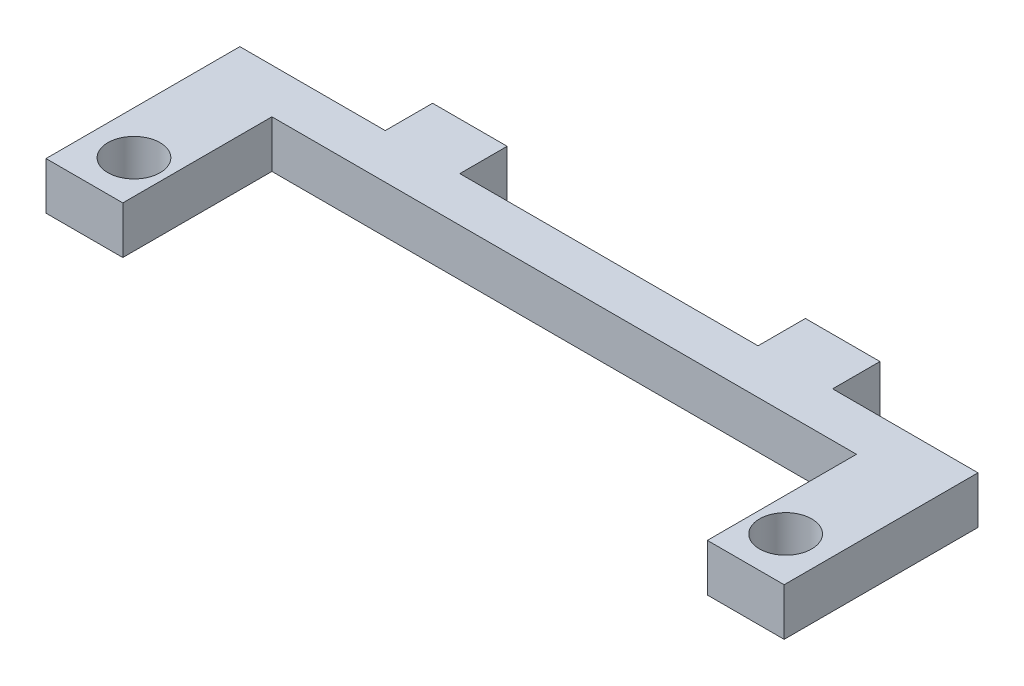
from build123d import *

# Parameters (mm, degrees)
SKETCH1_R           = 1.75
BOSS_EXTRUDE1_DEPTH = 3.175


with BuildPart() as part:
    # Sketch1 → Boss-Extrude1 (new body)
    with BuildSketch(Plane(origin=(0, 0, 0), x_dir=(1, 0, 0), z_dir=(0, 1, 0))):
        Polygon((-24.75, -3), (-24.75, 10), (-15, 10), (-15, 13.175), (-10, 13.175), (-10, 10), (10, 10), (10, 13.175), (15, 13.175), (15, 10), (24.75, 10), (24.75, -3), (19.6, -3), (19.6, 7), (-19.6, 7), (-19.6, -3), align=None)
        with Locations(Location((-21.85, 0, 0), (0, 0, 270))):
            Circle(SKETCH1_R, mode=Mode.SUBTRACT)
        with Locations(Location((21.85, 0, 0), (0, 0, 270))):
            Circle(SKETCH1_R, mode=Mode.SUBTRACT)
    extrude(amount=BOSS_EXTRUDE1_DEPTH)


solid = part.part
